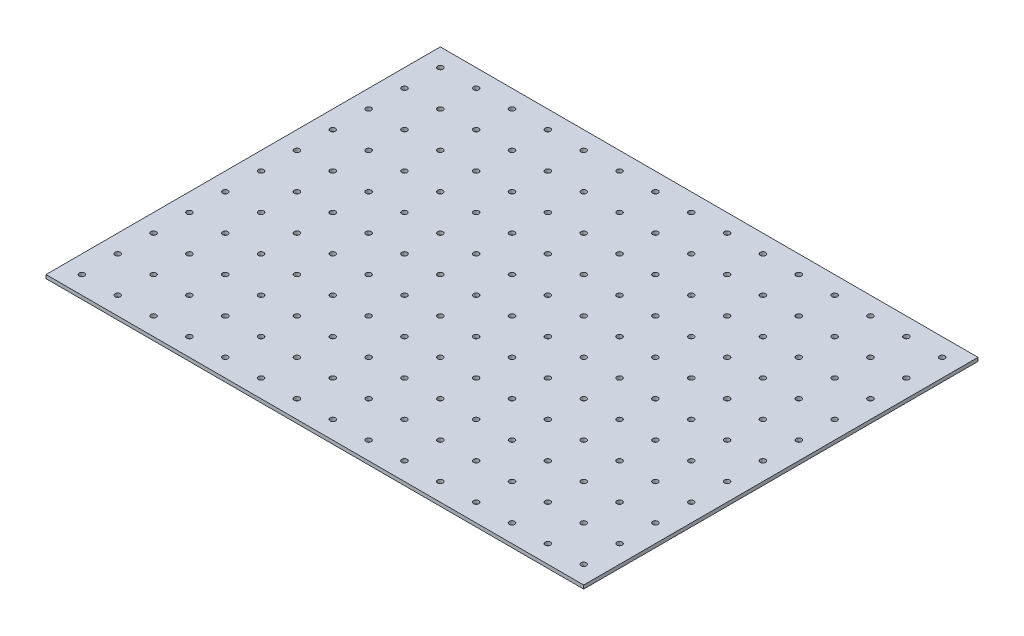
from build123d import *

# Parameters (mm, degrees)
SKETCH1_W           = 300
SKETCH1_H           = 2
BOSS_EXTRUDE1_DEPTH = 110
SKETCH2_R           = 1.5
CUT_EXTRUDE1_DEPTH  = 2


with BuildPart() as part:
    # Sketch1 → Boss-Extrude1 (new, symmetric)
    with BuildSketch(Plane.XY):
        Rectangle(SKETCH1_W, SKETCH1_H)
    extrude(amount=BOSS_EXTRUDE1_DEPTH, both=True)

    # Sketch2 → Cut-Extrude1 (cut)
    with BuildSketch(Plane(origin=(0, 1, 0), x_dir=(1, 0, 0), z_dir=(0, 1, 0))):
        with Locations(Location((-140, -100, 0), (0, 0, 270))):
            Circle(SKETCH2_R)
        with Locations(Location((-120, -100, 0), (0, 0, 270))):
            Circle(SKETCH2_R)
        with Locations(Location((-100, -100, 0), (0, 0, 270))):
            Circle(SKETCH2_R)
        with Locations(Location((-80, -100, 0), (0, 0, 270))):
            Circle(SKETCH2_R)
        with Locations(Location((-60, -100, 0), (0, 0, 270))):
            Circle(SKETCH2_R)
        with Locations(Location((-40, -100, 0), (0, 0, 270))):
            Circle(SKETCH2_R)
        with Locations(Location((-20, -100, 0), (0, 0, 270))):
            Circle(SKETCH2_R)
        with Locations(Location((0, -100, 0), (0, 0, 270))):
            Circle(SKETCH2_R)
        with Locations(Location((20, -100, 0), (0, 0, 270))):
            Circle(SKETCH2_R)
        with Locations(Location((40, -100, 0), (0, 0, 270))):
            Circle(SKETCH2_R)
        with Locations(Location((60, -100, 0), (0, 0, 270))):
            Circle(SKETCH2_R)
        with Locations(Location((80, -100, 0), (0, 0, 270))):
            Circle(SKETCH2_R)
        with Locations(Location((100, -100, 0), (0, 0, 270))):
            Circle(SKETCH2_R)
        with Locations(Location((120, -100, 0), (0, 0, 270))):
            Circle(SKETCH2_R)
        with Locations(Location((140, -100, 0), (0, 0, 270))):
            Circle(SKETCH2_R)
        with Locations(Location((-120, -80, 0), (0, 0, 270))):
            Circle(SKETCH2_R)
        with Locations(Location((-100, -80, 0), (0, 0, 270))):
            Circle(SKETCH2_R)
        with Locations(Location((-80, -80, 0), (0, 0, 270))):
            Circle(SKETCH2_R)
        with Locations(Location((-60, -80, 0), (0, 0, 270))):
            Circle(SKETCH2_R)
        with Locations(Location((-40, -80, 0), (0, 0, 270))):
            Circle(SKETCH2_R)
        with Locations(Location((-20, -80, 0), (0, 0, 270))):
            Circle(SKETCH2_R)
        with Locations(Location((0, -80, 0), (0, 0, 270))):
            Circle(SKETCH2_R)
        with Locations(Location((20, -80, 0), (0, 0, 270))):
            Circle(SKETCH2_R)
        with Locations(Location((40, -80, 0), (0, 0, 270))):
            Circle(SKETCH2_R)
        with Locations(Location((60, -80, 0), (0, 0, 270))):
            Circle(SKETCH2_R)
        with Locations(Location((80, -80, 0), (0, 0, 270))):
            Circle(SKETCH2_R)
        with Locations(Location((100, -80, 0), (0, 0, 270))):
            Circle(SKETCH2_R)
        with Locations(Location((120, -80, 0), (0, 0, 270))):
            Circle(SKETCH2_R)
        with Locations(Location((140, -80, 0), (0, 0, 270))):
            Circle(SKETCH2_R)
        with Locations(Location((-120, -60, 0), (0, 0, 270))):
            Circle(SKETCH2_R)
        with Locations(Location((-100, -60, 0), (0, 0, 270))):
            Circle(SKETCH2_R)
        with Locations(Location((-80, -60, 0), (0, 0, 270))):
            Circle(SKETCH2_R)
        with Locations(Location((-60, -60, 0), (0, 0, 270))):
            Circle(SKETCH2_R)
        with Locations(Location((-40, -60, 0), (0, 0, 270))):
            Circle(SKETCH2_R)
        with Locations(Location((-20, -60, 0), (0, 0, 270))):
            Circle(SKETCH2_R)
        with Locations(Location((0, -60, 0), (0, 0, 270))):
            Circle(SKETCH2_R)
        with Locations(Location((20, -60, 0), (0, 0, 270))):
            Circle(SKETCH2_R)
        with Locations(Location((40, -60, 0), (0, 0, 270))):
            Circle(SKETCH2_R)
        with Locations(Location((60, -60, 0), (0, 0, 270))):
            Circle(SKETCH2_R)
        with Locations(Location((80, -60, 0), (0, 0, 270))):
            Circle(SKETCH2_R)
        with Locations(Location((100, -60, 0), (0, 0, 270))):
            Circle(SKETCH2_R)
        with Locations(Location((120, -60, 0), (0, 0, 270))):
            Circle(SKETCH2_R)
        with Locations(Location((140, -60, 0), (0, 0, 270))):
            Circle(SKETCH2_R)
        with Locations(Location((-120, -40, 0), (0, 0, 270))):
            Circle(SKETCH2_R)
        with Locations(Location((-100, -40, 0), (0, 0, 270))):
            Circle(SKETCH2_R)
        with Locations(Location((-80, -40, 0), (0, 0, 270))):
            Circle(SKETCH2_R)
        with Locations(Location((-60, -40, 0), (0, 0, 270))):
            Circle(SKETCH2_R)
        with Locations(Location((-40, -40, 0), (0, 0, 270))):
            Circle(SKETCH2_R)
        with Locations(Location((-20, -40, 0), (0, 0, 270))):
            Circle(SKETCH2_R)
        with Locations(Location((0, -40, 0), (0, 0, 270))):
            Circle(SKETCH2_R)
        with Locations(Location((20, -40, 0), (0, 0, 270))):
            Circle(SKETCH2_R)
        with Locations(Location((40, -40, 0), (0, 0, 270))):
            Circle(SKETCH2_R)
        with Locations(Location((60, -40, 0), (0, 0, 270))):
            Circle(SKETCH2_R)
        with Locations(Location((80, -40, 0), (0, 0, 270))):
            Circle(SKETCH2_R)
        with Locations(Location((100, -40, 0), (0, 0, 270))):
            Circle(SKETCH2_R)
        with Locations(Location((120, -40, 0), (0, 0, 270))):
            Circle(SKETCH2_R)
        with Locations(Location((140, -40, 0), (0, 0, 270))):
            Circle(SKETCH2_R)
        with Locations(Location((-120, -20, 0), (0, 0, 270))):
            Circle(SKETCH2_R)
        with Locations(Location((-100, -20, 0), (0, 0, 270))):
            Circle(SKETCH2_R)
        with Locations(Location((-80, -20, 0), (0, 0, 270))):
            Circle(SKETCH2_R)
        with Locations(Location((-60, -20, 0), (0, 0, 270))):
            Circle(SKETCH2_R)
        with Locations(Location((-40, -20, 0), (0, 0, 270))):
            Circle(SKETCH2_R)
        with Locations(Location((-20, -20, 0), (0, 0, 270))):
            Circle(SKETCH2_R)
        with Locations(Location((0, -20, 0), (0, 0, 270))):
            Circle(SKETCH2_R)
        with Locations(Location((20, -20, 0), (0, 0, 270))):
            Circle(SKETCH2_R)
        with Locations(Location((40, -20, 0), (0, 0, 270))):
            Circle(SKETCH2_R)
        with Locations(Location((60, -20, 0), (0, 0, 270))):
            Circle(SKETCH2_R)
        with Locations(Location((80, -20, 0), (0, 0, 270))):
            Circle(SKETCH2_R)
        with Locations(Location((100, -20, 0), (0, 0, 270))):
            Circle(SKETCH2_R)
        with Locations(Location((120, -20, 0), (0, 0, 270))):
            Circle(SKETCH2_R)
        with Locations(Location((140, -20, 0), (0, 0, 270))):
            Circle(SKETCH2_R)
        with Locations(Location((-120, 0, 0), (0, 0, 270))):
            Circle(SKETCH2_R)
        with Locations(Location((-100, 0, 0), (0, 0, 270))):
            Circle(SKETCH2_R)
        with Locations(Location((-80, 0, 0), (0, 0, 270))):
            Circle(SKETCH2_R)
        with Locations(Location((-60, 0, 0), (0, 0, 270))):
            Circle(SKETCH2_R)
        with Locations(Location((-40, 0, 0), (0, 0, 270))):
            Circle(SKETCH2_R)
        with Locations(Location((-20, 0, 0), (0, 0, 270))):
            Circle(SKETCH2_R)
        with Locations(Location((0, 0, 0), (0, 0, 270))):
            Circle(SKETCH2_R)
        with Locations(Location((20, 0, 0), (0, 0, 270))):
            Circle(SKETCH2_R)
        with Locations(Location((40, 0, 0), (0, 0, 270))):
            Circle(SKETCH2_R)
        with Locations(Location((60, 0, 0), (0, 0, 270))):
            Circle(SKETCH2_R)
        with Locations(Location((80, 0, 0), (0, 0, 270))):
            Circle(SKETCH2_R)
        with Locations(Location((100, 0, 0), (0, 0, 270))):
            Circle(SKETCH2_R)
        with Locations(Location((120, 0, 0), (0, 0, 270))):
            Circle(SKETCH2_R)
        with Locations(Location((140, 0, 0), (0, 0, 270))):
            Circle(SKETCH2_R)
        with Locations(Location((-120, 20, 0), (0, 0, 270))):
            Circle(SKETCH2_R)
        with Locations(Location((-100, 20, 0), (0, 0, 270))):
            Circle(SKETCH2_R)
        with Locations(Location((-80, 20, 0), (0, 0, 270))):
            Circle(SKETCH2_R)
        with Locations(Location((-60, 20, 0), (0, 0, 270))):
            Circle(SKETCH2_R)
        with Locations(Location((-40, 20, 0), (0, 0, 270))):
            Circle(SKETCH2_R)
        with Locations(Location((-20, 20, 0), (0, 0, 270))):
            Circle(SKETCH2_R)
        with Locations(Location((0, 20, 0), (0, 0, 270))):
            Circle(SKETCH2_R)
        with Locations(Location((20, 20, 0), (0, 0, 270))):
            Circle(SKETCH2_R)
        with Locations(Location((40, 20, 0), (0, 0, 270))):
            Circle(SKETCH2_R)
        with Locations(Location((60, 20, 0), (0, 0, 270))):
            Circle(SKETCH2_R)
        with Locations(Location((80, 20, 0), (0, 0, 270))):
            Circle(SKETCH2_R)
        with Locations(Location((100, 20, 0), (0, 0, 270))):
            Circle(SKETCH2_R)
        with Locations(Location((120, 20, 0), (0, 0, 270))):
            Circle(SKETCH2_R)
        with Locations(Location((140, 20, 0), (0, 0, 270))):
            Circle(SKETCH2_R)
        with Locations(Location((-120, 40, 0), (0, 0, 270))):
            Circle(SKETCH2_R)
        with Locations(Location((-100, 40, 0), (0, 0, 270))):
            Circle(SKETCH2_R)
        with Locations(Location((-80, 40, 0), (0, 0, 270))):
            Circle(SKETCH2_R)
        with Locations(Location((-60, 40, 0), (0, 0, 270))):
            Circle(SKETCH2_R)
        with Locations(Location((-40, 40, 0), (0, 0, 270))):
            Circle(SKETCH2_R)
        with Locations(Location((-20, 40, 0), (0, 0, 270))):
            Circle(SKETCH2_R)
        with Locations(Location((0, 40, 0), (0, 0, 270))):
            Circle(SKETCH2_R)
        with Locations(Location((20, 40, 0), (0, 0, 270))):
            Circle(SKETCH2_R)
        with Locations(Location((40, 40, 0), (0, 0, 270))):
            Circle(SKETCH2_R)
        with Locations(Location((60, 40, 0), (0, 0, 270))):
            Circle(SKETCH2_R)
        with Locations(Location((80, 40, 0), (0, 0, 270))):
            Circle(SKETCH2_R)
        with Locations(Location((100, 40, 0), (0, 0, 270))):
            Circle(SKETCH2_R)
        with Locations(Location((120, 40, 0), (0, 0, 270))):
            Circle(SKETCH2_R)
        with Locations(Location((140, 40, 0), (0, 0, 270))):
            Circle(SKETCH2_R)
        with Locations(Location((-120, 60, 0), (0, 0, 270))):
            Circle(SKETCH2_R)
        with Locations(Location((-100, 60, 0), (0, 0, 270))):
            Circle(SKETCH2_R)
        with Locations(Location((-80, 60, 0), (0, 0, 270))):
            Circle(SKETCH2_R)
        with Locations(Location((-60, 60, 0), (0, 0, 270))):
            Circle(SKETCH2_R)
        with Locations(Location((-40, 60, 0), (0, 0, 270))):
            Circle(SKETCH2_R)
        with Locations(Location((-20, 60, 0), (0, 0, 270))):
            Circle(SKETCH2_R)
        with Locations(Location((0, 60, 0), (0, 0, 270))):
            Circle(SKETCH2_R)
        with Locations(Location((20, 60, 0), (0, 0, 270))):
            Circle(SKETCH2_R)
        with Locations(Location((40, 60, 0), (0, 0, 270))):
            Circle(SKETCH2_R)
        with Locations(Location((60, 60, 0), (0, 0, 270))):
            Circle(SKETCH2_R)
        with Locations(Location((80, 60, 0), (0, 0, 270))):
            Circle(SKETCH2_R)
        with Locations(Location((100, 60, 0), (0, 0, 270))):
            Circle(SKETCH2_R)
        with Locations(Location((120, 60, 0), (0, 0, 270))):
            Circle(SKETCH2_R)
        with Locations(Location((140, 60, 0), (0, 0, 270))):
            Circle(SKETCH2_R)
        with Locations(Location((-120, 80, 0), (0, 0, 270))):
            Circle(SKETCH2_R)
        with Locations(Location((-100, 80, 0), (0, 0, 270))):
            Circle(SKETCH2_R)
        with Locations(Location((-80, 80, 0), (0, 0, 270))):
            Circle(SKETCH2_R)
        with Locations(Location((-60, 80, 0), (0, 0, 270))):
            Circle(SKETCH2_R)
        with Locations(Location((-40, 80, 0), (0, 0, 270))):
            Circle(SKETCH2_R)
        with Locations(Location((-20, 80, 0), (0, 0, 270))):
            Circle(SKETCH2_R)
        with Locations(Location((0, 80, 0), (0, 0, 270))):
            Circle(SKETCH2_R)
        with Locations(Location((20, 80, 0), (0, 0, 270))):
            Circle(SKETCH2_R)
        with Locations(Location((40, 80, 0), (0, 0, 270))):
            Circle(SKETCH2_R)
        with Locations(Location((60, 80, 0), (0, 0, 270))):
            Circle(SKETCH2_R)
        with Locations(Location((80, 80, 0), (0, 0, 270))):
            Circle(SKETCH2_R)
        with Locations(Location((100, 80, 0), (0, 0, 270))):
            Circle(SKETCH2_R)
        with Locations(Location((120, 80, 0), (0, 0, 270))):
            Circle(SKETCH2_R)
        with Locations(Location((140, 80, 0), (0, 0, 270))):
            Circle(SKETCH2_R)
        with Locations(Location((-120, 100, 0), (0, 0, 270))):
            Circle(SKETCH2_R)
        with Locations(Location((-100, 100, 0), (0, 0, 270))):
            Circle(SKETCH2_R)
        with Locations(Location((-80, 100, 0), (0, 0, 270))):
            Circle(SKETCH2_R)
        with Locations(Location((-60, 100, 0), (0, 0, 270))):
            Circle(SKETCH2_R)
        with Locations(Location((-40, 100, 0), (0, 0, 270))):
            Circle(SKETCH2_R)
        with Locations(Location((-20, 100, 0), (0, 0, 270))):
            Circle(SKETCH2_R)
        with Locations(Location((0, 100, 0), (0, 0, 270))):
            Circle(SKETCH2_R)
        with Locations(Location((20, 100, 0), (0, 0, 270))):
            Circle(SKETCH2_R)
        with Locations(Location((40, 100, 0), (0, 0, 270))):
            Circle(SKETCH2_R)
        with Locations(Location((60, 100, 0), (0, 0, 270))):
            Circle(SKETCH2_R)
        with Locations(Location((80, 100, 0), (0, 0, 270))):
            Circle(SKETCH2_R)
        with Locations(Location((100, 100, 0), (0, 0, 270))):
            Circle(SKETCH2_R)
        with Locations(Location((120, 100, 0), (0, 0, 270))):
            Circle(SKETCH2_R)
        with Locations(Location((140, 100, 0), (0, 0, 270))):
            Circle(SKETCH2_R)
        with Locations(Location((-140, -80, 0), (0, 0, 270))):
            Circle(SKETCH2_R)
        with Locations(Location((-140, -60, 0), (0, 0, 270))):
            Circle(SKETCH2_R)
        with Locations(Location((-140, -40, 0), (0, 0, 270))):
            Circle(SKETCH2_R)
        with Locations(Location((-140, -20, 0), (0, 0, 270))):
            Circle(SKETCH2_R)
        with Locations(Location((-140, 0, 0), (0, 0, 270))):
            Circle(SKETCH2_R)
        with Locations(Location((-140, 20, 0), (0, 0, 270))):
            Circle(SKETCH2_R)
        with Locations(Location((-140, 40, 0), (0, 0, 270))):
            Circle(SKETCH2_R)
        with Locations(Location((-140, 60, 0), (0, 0, 270))):
            Circle(SKETCH2_R)
        with Locations(Location((-140, 80, 0), (0, 0, 270))):
            Circle(SKETCH2_R)
        with Locations(Location((-140, 100, 0), (0, 0, 270))):
            Circle(SKETCH2_R)
    extrude(amount=-CUT_EXTRUDE1_DEPTH, mode=Mode.SUBTRACT)


solid = part.part
